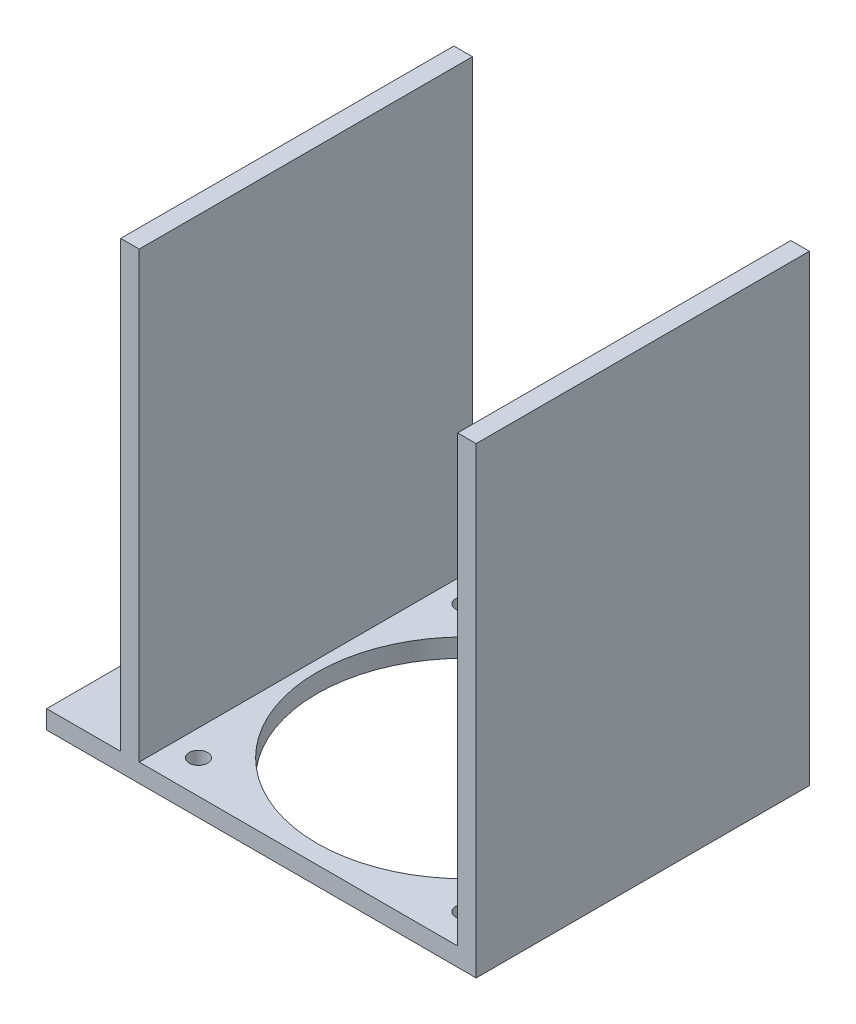
from build123d import *

# Parameters (mm, degrees)
SKETCH1_W           = 116
SKETCH1_H           = 90
BOSS_EXTRUDE1_DEPTH = 5
SKETCH2_W           = 5
SKETCH2_H           = 90
BOSS_EXTRUDE2_DEPTH = 120
SKETCH3_R           = 40
CUT_EXTRUDE1_DEPTH  = 15
SKETCH4_R           = 2.5
CUT_EXTRUDE2_DEPTH  = 15
SKETCH5_W           = 5
SKETCH5_H           = 90
BOSS_EXTRUDE3_DEPTH = 120


with BuildPart() as part:
    # Sketch1 → Boss-Extrude1 (new body)
    with BuildSketch(Plane(origin=(0, 0, 0), x_dir=(1, 0, 0), z_dir=(0, 1, 0))):
        with Locations((58, 45)):
            Rectangle(SKETCH1_W, SKETCH1_H)
    extrude(amount=BOSS_EXTRUDE1_DEPTH)

    # Sketch2 → Boss-Extrude2 (add)
    with BuildSketch(Plane(origin=(0, 5, 0), x_dir=(1, 0, 0), z_dir=(0, 1, 0))):
        with Locations((113.5, 45)):
            Rectangle(SKETCH2_W, SKETCH2_H)
    extrude(amount=BOSS_EXTRUDE2_DEPTH)

    # Sketch3 → Cut-Extrude1 (cut)
    with BuildSketch(Plane.XZ):
        with Locations(Location((68, -45, 0), (0, 0, 270))):
            Circle(SKETCH3_R)
    extrude(amount=-CUT_EXTRUDE1_DEPTH, mode=Mode.SUBTRACT)

    # Sketch4 → Cut-Extrude2 (cut)
    with BuildSketch(Plane.XZ):
        with Locations(Location((32, -9, 0), (0, 0, 270))):
            Circle(SKETCH4_R)
        with Locations(Location((104, -9, 0), (0, 0, 270))):
            Circle(SKETCH4_R)
        with Locations(Location((104, -81, 0), (0, 0, 270))):
            Circle(SKETCH4_R)
        with Locations(Location((32, -81, 0), (0, 0, 270))):
            Circle(SKETCH4_R)
    extrude(amount=-CUT_EXTRUDE2_DEPTH, mode=Mode.SUBTRACT)

    # Sketch5 → Boss-Extrude3 (add)
    with BuildSketch(Plane(origin=(0, 5, 0), x_dir=(1, 0, 0), z_dir=(0, 1, 0))):
        with Locations((22.5, 45)):
            Rectangle(SKETCH5_W, SKETCH5_H)
    extrude(amount=BOSS_EXTRUDE3_DEPTH)


solid = part.part
